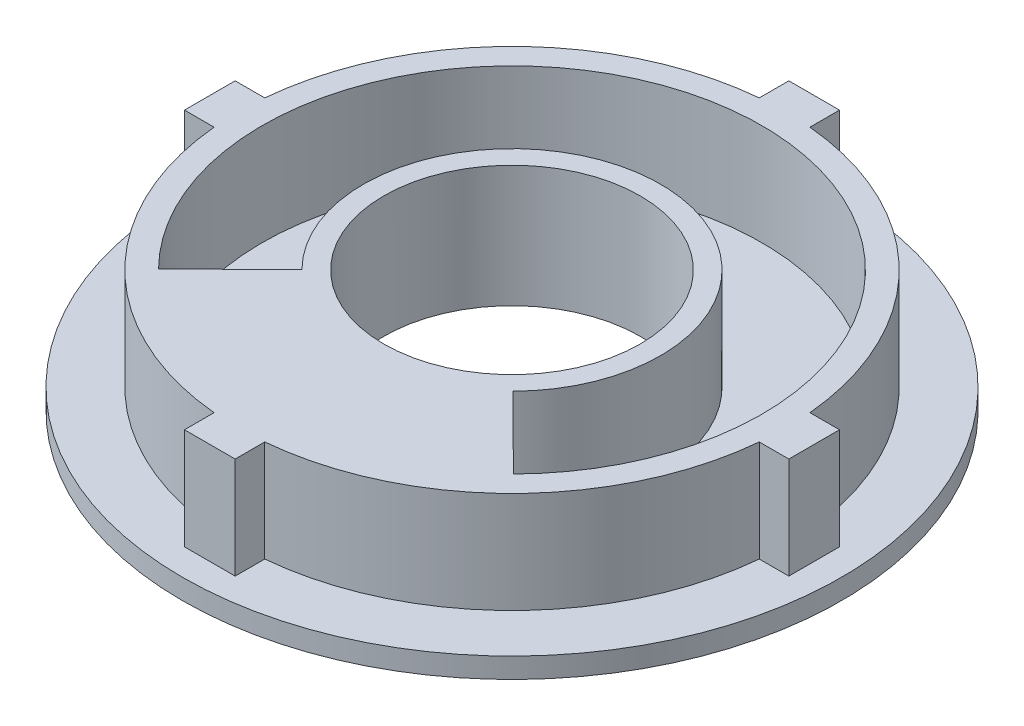
from build123d import *
from build123d.topology import SkipClean

# Parameters (mm, degrees)
SKETCH1_R           = 27
SKETCH1_R_2         = 12.65
BOSS_EXTRUDE1_DEPTH = 10
BOSS_EXTRUDE2_START = 2
SKETCH2_R           = 32.5
SKETCH2_R_2         = 12.65
BOSS_EXTRUDE2_DEPTH = 2
SKETCH3_W           = 5
SKETCH3_H           = 4.39677325
SKETCH3_W_2         = 4.39677325
SKETCH3_H_2         = 5
BOSS_EXTRUDE3_DEPTH = 10


with BuildPart() as part:
    # Sketch1 → Boss-Extrude1 (new body)
    with BuildSketch(Plane(origin=(0, 0, 0), x_dir=(1, 0, 0), z_dir=(0, 1, 0))):
        with Locations(Location((0, 0, 0), (0, 0, 270))):
            Circle(SKETCH1_R)
        with Locations(Location((0, 0, 0), (0, 0, 270))):
            Circle(SKETCH1_R_2, mode=Mode.SUBTRACT)
        with BuildLine():
            Line((-17.5, -17.360083525), (-10.400608519, -10.317453292))
            ThreePointArc((-10.400608519, -10.317453292), (0, 14.65), (10.400608519, -10.317453292))
            Line((10.400608519, -10.317453292), (17.5, -17.360083525))
            ThreePointArc((17.5, -17.360083525), (0, 24.65), (-17.5, -17.360083525))
        make_face(mode=Mode.SUBTRACT)
    extrude(amount=BOSS_EXTRUDE1_DEPTH)

    # Sketch2 → Boss-Extrude2 (add)
    with SkipClean():  # the faces are left unmerged after this step: merging them gives an invalid solid
        with BuildSketch(Plane.XZ.offset(BOSS_EXTRUDE2_START)):
            with Locations(Location((0, 0, 0), (0, 0, 270))):
                Circle(SKETCH2_R)
            with Locations(Location((0, 0, 0), (0, 0, 270))):
                Circle(SKETCH2_R_2, mode=Mode.SUBTRACT)
        extrude(amount=-BOSS_EXTRUDE2_DEPTH)

    # Sketch3 → Boss-Extrude3 (add)
    with SkipClean():  # the faces are left unmerged after this step: merging them gives an invalid solid
        with BuildSketch(Plane(origin=(0, 0, 0), x_dir=(1, 0, 0), z_dir=(0, 1, 0))):
            with Locations((0, 27.601613375)):
                Rectangle(SKETCH3_W, SKETCH3_H)
            with Locations((27.601613375, 0)):
                Rectangle(SKETCH3_W_2, SKETCH3_H_2)
            with Locations((0, -27.601613375)):
                Rectangle(SKETCH3_W, SKETCH3_H)
            with Locations((-27.601613375, 0)):
                Rectangle(SKETCH3_W_2, SKETCH3_H_2)
        extrude(amount=BOSS_EXTRUDE3_DEPTH)


solid = part.part
